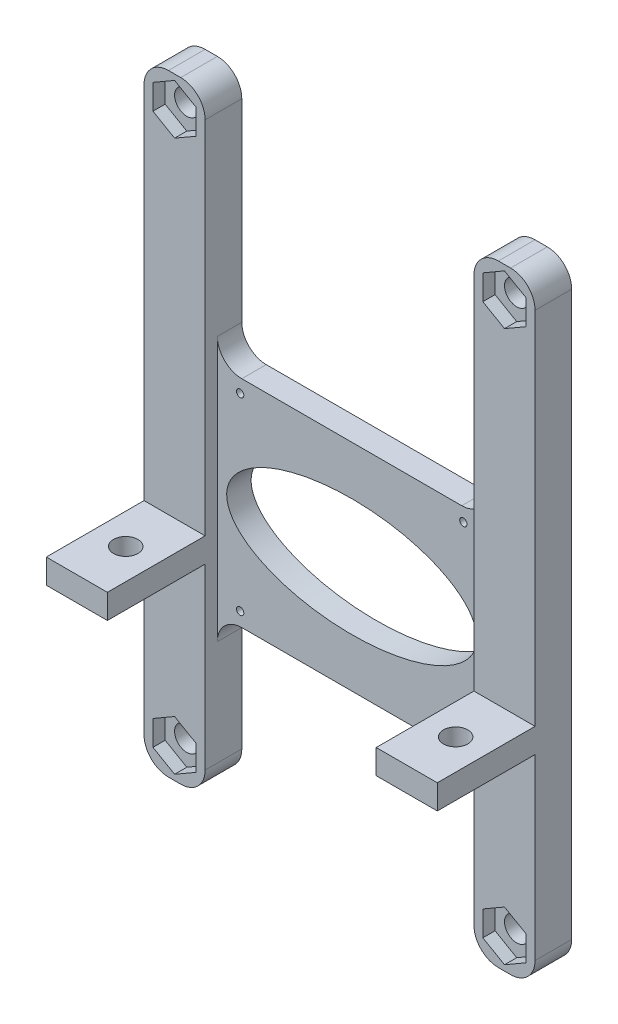
from build123d import *

# Parameters (mm, degrees)
SKETCH1_R           = 0.95
SKETCH1_R_2         = 3.175
SKETCH1_RX          = 32.5
SKETCH1_RY          = 15.3
BOSS_EXTRUDE1_DEPTH = 6.35
SKETCH2_W           = 15.875
SKETCH2_H           = 159.01875
BOSS_EXTRUDE2_DEPTH = 3.175
SKETCH3_W           = 15.875
SKETCH3_H           = 6.35
BOSS_EXTRUDE3_DEPTH = 25.4
SKETCH4_R           = 3.175
CUT_EXTRUDE1_DEPTH  = 123.890515655
FILLET2_R           = 6.35


with BuildPart() as part:
    # Sketch1 → Boss-Extrude1 (new body)
    with BuildSketch(Plane.XY):
        Polygon((-50.8, -79.509375), (-50.8, 79.509375), (-34.925, 79.509375), (-34.925, 16.5), (34.925, 16.5), (34.925, 79.509375), (50.8, 79.509375), (50.8, -79.509375), (34.925, -79.509375), (34.925, -39.5), (-34.925, -39.5), (-34.925, -79.509375), align=None)
        with Locations((29, 13)):
            Circle(SKETCH1_R, mode=Mode.SUBTRACT)
        with Locations((29, -36)):
            Circle(SKETCH1_R, mode=Mode.SUBTRACT)
        with Locations((-29, -36)):
            Circle(SKETCH1_R, mode=Mode.SUBTRACT)
        with Locations((-29, 13)):
            Circle(SKETCH1_R, mode=Mode.SUBTRACT)
        with Locations((-42.8625, 71.571875)):
            Circle(SKETCH1_R_2, mode=Mode.SUBTRACT)
        with Locations(Location((42.8625, 71.571875, 0), (0, 0, 180))):
            Circle(SKETCH1_R_2, mode=Mode.SUBTRACT)
        with Locations(Location((-42.8625, -71.571875, 0), (0, 0, 180))):
            Circle(SKETCH1_R_2, mode=Mode.SUBTRACT)
        with Locations((42.8625, -71.571875)):
            Circle(SKETCH1_R_2, mode=Mode.SUBTRACT)
        with Locations(Location((0, -11.5), (0, 0, 0))):
            Ellipse(SKETCH1_RX, SKETCH1_RY, mode=Mode.SUBTRACT)
    extrude(amount=BOSS_EXTRUDE1_DEPTH)

    # Sketch2 → Boss-Extrude2 (add)
    # profile 1 of 2: a face of its own
    with BuildSketch(Plane.XY.offset(6.35)):
        with Locations((-42.8625, 0)):
            Rectangle(SKETCH2_W, SKETCH2_H)
        Polygon((-48.4875, 68.324279736), (-42.8625, 65.076684472), (-37.2375, 68.324279736), (-37.2375, 74.819470264), (-42.8625, 78.067065528), (-48.4875, 74.819470264), align=None, mode=Mode.SUBTRACT)
        Polygon((-37.2375, -68.324279736), (-42.8625, -65.076684472), (-48.4875, -68.324279736), (-48.4875, -74.819470264), (-42.8625, -78.067065528), (-37.2375, -74.819470264), align=None, mode=Mode.SUBTRACT)
    # profile 2 of 2: a face of its own
    with BuildSketch(Plane.XY.offset(6.35)):
        with Locations((42.8625, 0)):
            Rectangle(SKETCH2_W, SKETCH2_H)
        Polygon((37.2375, -74.819470264), (37.2375, -68.324279736), (42.8625, -65.076684472), (48.4875, -68.324279736), (48.4875, -74.819470264), (42.8625, -78.067065528), align=None, mode=Mode.SUBTRACT)
        Polygon((48.4875, 74.819470264), (48.4875, 68.324279736), (42.8625, 65.076684472), (37.2375, 68.324279736), (37.2375, 74.819470264), (42.8625, 78.067065528), align=None, mode=Mode.SUBTRACT)
    extrude(amount=BOSS_EXTRUDE2_DEPTH)

    # Sketch3 → Boss-Extrude3 (add)
    with BuildSketch(Plane.XY.offset(9.525)):
        with Locations((-42.8625, -23.625)):
            Rectangle(SKETCH3_W, SKETCH3_H)
        with Locations((42.8625, -23.625)):
            Rectangle(SKETCH3_W, SKETCH3_H)
    extrude(amount=BOSS_EXTRUDE3_DEPTH)

    # Sketch4 → Cut-Extrude1 (cut, through all)
    with BuildSketch(Plane(origin=(0, -26.8, 0), x_dir=(1, 0, 0), z_dir=(0, 1, 0))):
        with Locations((-42.8625, -22.225)):
            Circle(SKETCH4_R)
        with Locations((42.8625, -22.225)):
            Circle(SKETCH4_R)
    extrude(amount=CUT_EXTRUDE1_DEPTH, mode=Mode.SUBTRACT)

    # Fillet2
    fillet2_edges = [part.edges().sort_by_distance(p)[0] for p in [
        (-50.8, -79.509375, 4.7625),
        (-50.8, 79.509375, 4.7625),
        (-34.925, 79.509375, 4.7625),
        (-34.925, 16.5, 3.175),
        (34.925, 16.5, 3.175),
        (34.925, 79.509375, 4.7625),
        (50.8, 79.509375, 4.7625),
        (50.8, -79.509375, 4.7625),
        (34.925, -79.509375, 4.7625),
        (34.925, -39.5, 3.175),
        (-34.925, -39.5, 3.175),
        (-34.925, -79.509375, 4.7625),
    ]]
    fillet(fillet2_edges, radius=FILLET2_R)


solid = part.part
